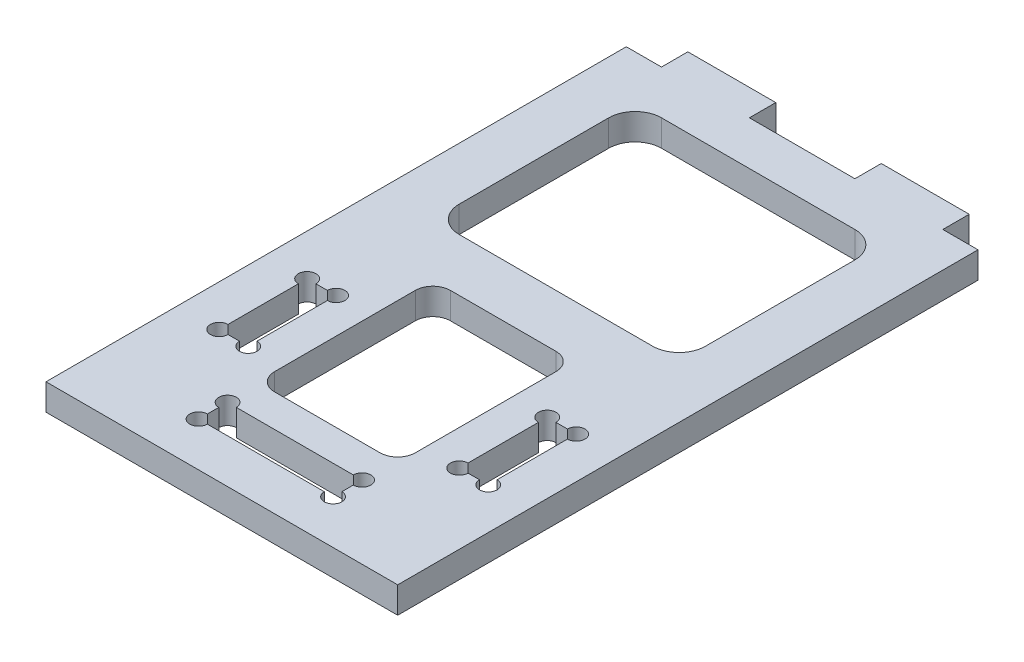
from build123d import *

# Parameters (mm, degrees)
EXTRUDE_1_DEPTH          = 3
CUT_EXTRUDE_1_DEPTH      = 55.863466897
CUT_EXTRUDE_1_DEPTH_BACK = 55.863466897
SKETCH_2_W               = 16
SKETCH_2_H               = 20
FILLET_1_R               = 2
SKETCH_3_W               = 28
SKETCH_3_H               = 23
CUT_EXTRUDE_2_DEPTH      = 10
FILLET_2_R               = 3


with BuildPart() as part:
    # 草图1 → 凸台-拉伸1 (new body)
    with BuildSketch(Plane(origin=(0, 0, 0), x_dir=(1, 0, 0), z_dir=(0, 1, 0))):
        Polygon((20, 48), (16, 48), (16, 51), (6, 51), (6, 48), (-6, 48), (-6, 51), (-16, 51), (-16, 48), (-20, 48), (-20, -18), (20, -18), align=None)
        with BuildLine():
            Line((15.3, 6), (15.3, -2))
            ThreePointArc((15.3, -2), (16.007106781, -3.707106781), (14.3, -3))
            Line((14.3, -3), (13, -3))
            ThreePointArc((13, -3), (11.292893219, -3.707106781), (12, -2))
            Line((12, -2), (12, 6))
            ThreePointArc((12, 6), (11.292893219, 7.707106781), (13, 7))
            Line((13, 7), (14.3, 7))
            ThreePointArc((14.3, 7), (16.007106781, 7.707106781), (15.3, 6))
        make_face(mode=Mode.SUBTRACT)
        with BuildLine():
            Line((-12, 6), (-12, -2))
            ThreePointArc((-12, -2), (-11.292893219, -3.707106781), (-13, -3))
            Line((-13, -3), (-14.3, -3))
            ThreePointArc((-14.3, -3), (-16.007106781, -3.707106781), (-15.3, -2))
            Line((-15.3, -2), (-15.3, 6))
            ThreePointArc((-15.3, 6), (-16.007106781, 7.707106781), (-14.3, 7))
            Line((-14.3, 7), (-13, 7))
            ThreePointArc((-13, 7), (-11.292893219, 7.707106781), (-12, 6))
        make_face(mode=Mode.SUBTRACT)
        with BuildLine():
            Line((-7.65, -12), (-7.65, -10.7))
            ThreePointArc((-7.65, -10.7), (-8.357106781, -8.992893219), (-6.65, -9.7))
            Line((-6.65, -9.7), (6.65, -9.7))
            ThreePointArc((6.65, -9.7), (8.357106781, -8.992893219), (7.65, -10.7))
            Line((7.65, -10.7), (7.65, -12))
            ThreePointArc((7.65, -12), (8.357106781, -13.707106781), (6.65, -13))
            Line((6.65, -13), (-6.65, -13))
            ThreePointArc((-6.65, -13), (-8.357106781, -13.707106781), (-7.65, -12))
        make_face(mode=Mode.SUBTRACT)
    extrude(amount=EXTRUDE_1_DEPTH)

    # 草图2 → 切除-拉伸1 (cut, two sides: drawn at the far end of the back side and taken through both)
    with BuildSketch(Plane(origin=(0, 3, 0), x_dir=(1, 0, 0), z_dir=(0, 1, 0)).offset(-CUT_EXTRUDE_1_DEPTH_BACK)):
        with Locations((0, 4)):
            Rectangle(SKETCH_2_W, SKETCH_2_H)
    extrude(amount=CUT_EXTRUDE_1_DEPTH + CUT_EXTRUDE_1_DEPTH_BACK, mode=Mode.SUBTRACT)

    # 圆角1
    fillet_1_edges = [part.edges().sort_by_distance(p)[0] for p in [
        (8, 1.5, -14),
        (8, 1.5, 6),
        (-8, 1.5, 6),
        (-8, 1.5, -14),
    ]]
    fillet(fillet_1_edges, radius=FILLET_1_R)

    # 草图3 → 切除-拉伸2 (cut)
    with BuildSketch(Plane(origin=(0, 3, 0), x_dir=(1, 0, 0), z_dir=(0, 1, 0))):
        with Locations((0, 31.5)):
            Rectangle(SKETCH_3_W, SKETCH_3_H)
    extrude(amount=-CUT_EXTRUDE_2_DEPTH, mode=Mode.SUBTRACT)

    # 圆角2
    fillet_2_edges = [part.edges().sort_by_distance(p)[0] for p in [
        (14, 1.5, -43),
        (14, 1.5, -20),
        (-14, 1.5, -20),
        (-14, 1.5, -43),
    ]]
    fillet(fillet_2_edges, radius=FILLET_2_R)


solid = part.part
